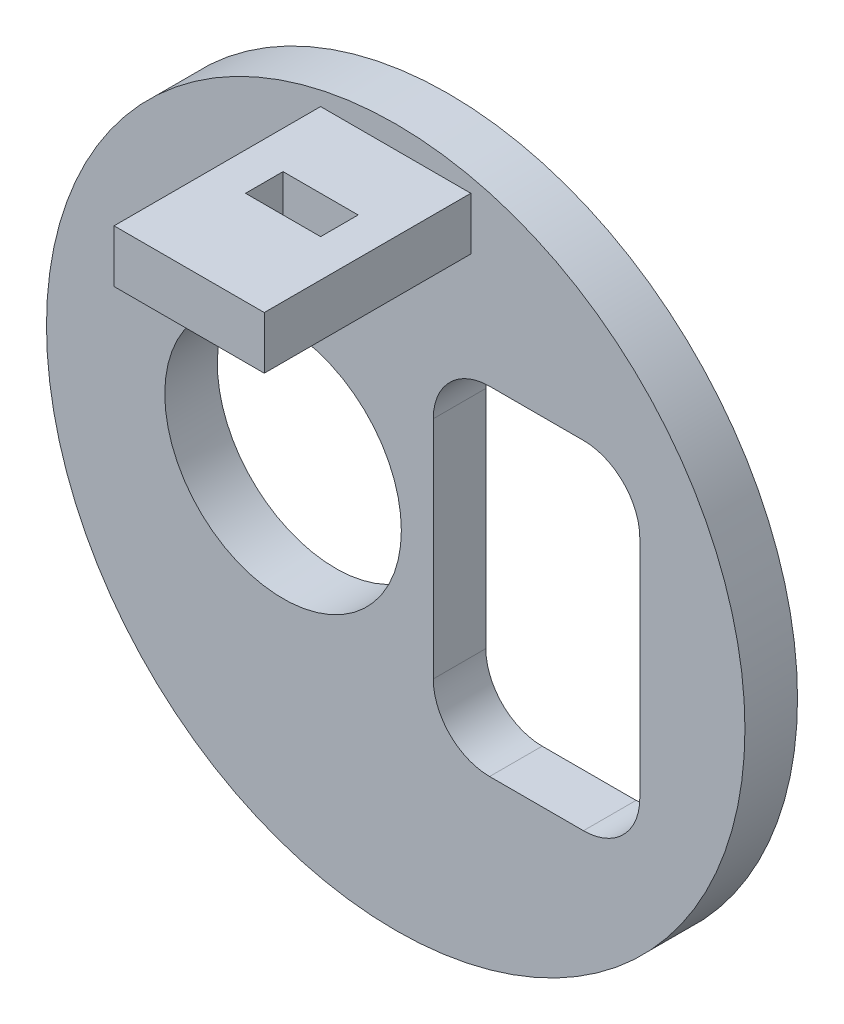
from build123d import *

# Parameters (mm, degrees)
SKETCH1_R                        = 18.6
CAP_DISC_DEPTH                   = 2.8
SKETCH2_W                        = 8
SKETCH2_H                        = 2.8
STRAIN_RELIEF_TAB_DEPTH          = 11
PH_ELECTRODE_BORE_DEPTH          = 71.512126617
PH_ELECTRODE_BORE_DEPTH_BACK     = 71.512126617
SKETCH3_R                        = 6.3
CABLE_AND_HOSE_WINDOW_DEPTH      = 71.512126617
CABLE_AND_HOSE_WINDOW_DEPTH_BACK = 71.512126617
ZIP_TIE_SLOT_DEPTH               = 106.59109811
ZIP_TIE_SLOT_DEPTH_BACK          = 106.59109811
SKETCH5_W                        = 4
SKETCH5_H                        = 2


with BuildPart() as part:
    # Sketch1 → Cap_disc (new body)
    with BuildSketch(Plane.XY.offset(61.8)):
        with Locations((48, 0)):
            Circle(SKETCH1_R)
    extrude(amount=CAP_DISC_DEPTH)

    # Sketch2 → Strain_relief_tab (add)
    with BuildSketch(Plane.XY.offset(64.6)):
        with Locations((48, 16)):
            Rectangle(SKETCH2_W, SKETCH2_H)
    extrude(amount=STRAIN_RELIEF_TAB_DEPTH)

    # Sketch3 → pH_electrode_bore (cut, two sides: drawn at the far end of the back side and taken through both)
    with BuildSketch(Plane.XY.offset(61.8).offset(-PH_ELECTRODE_BORE_DEPTH_BACK)):
        with Locations((42, 0)):
            Circle(SKETCH3_R)
    extrude(amount=PH_ELECTRODE_BORE_DEPTH + PH_ELECTRODE_BORE_DEPTH_BACK, mode=Mode.SUBTRACT)

    # Sketch4 → Cable_and_hose_window (cut, two sides: drawn at the far end of the back side and taken through both)
    with BuildSketch(Plane.XY.offset(61.8).offset(-CABLE_AND_HOSE_WINDOW_DEPTH_BACK)):
        with BuildLine():
            Line((53, -9), (58, -9))
            ThreePointArc((58, -9), (60.121320344, -8.121320344), (61, -6))
            Line((61, -6), (61, 6))
            ThreePointArc((61, 6), (60.121320344, 8.121320344), (58, 9))
            Line((58, 9), (53, 9))
            ThreePointArc((53, 9), (50.878679656, 8.121320344), (50, 6))
            Line((50, 6), (50, -6))
            ThreePointArc((50, -6), (50.878679656, -8.121320344), (53, -9))
        make_face()
    extrude(amount=CABLE_AND_HOSE_WINDOW_DEPTH + CABLE_AND_HOSE_WINDOW_DEPTH_BACK, mode=Mode.SUBTRACT)

    # Sketch5 → Zip_tie_slot (cut, two sides: drawn at the far end of the back side and taken through both)
    with BuildSketch(Plane(origin=(0, 13, 0), x_dir=(1, 0, 0), z_dir=(0, 1, 0)).offset(-ZIP_TIE_SLOT_DEPTH_BACK)):
        with Locations((48, -69.6)):
            Rectangle(SKETCH5_W, SKETCH5_H)
    extrude(amount=ZIP_TIE_SLOT_DEPTH + ZIP_TIE_SLOT_DEPTH_BACK, mode=Mode.SUBTRACT)


solid = part.part
